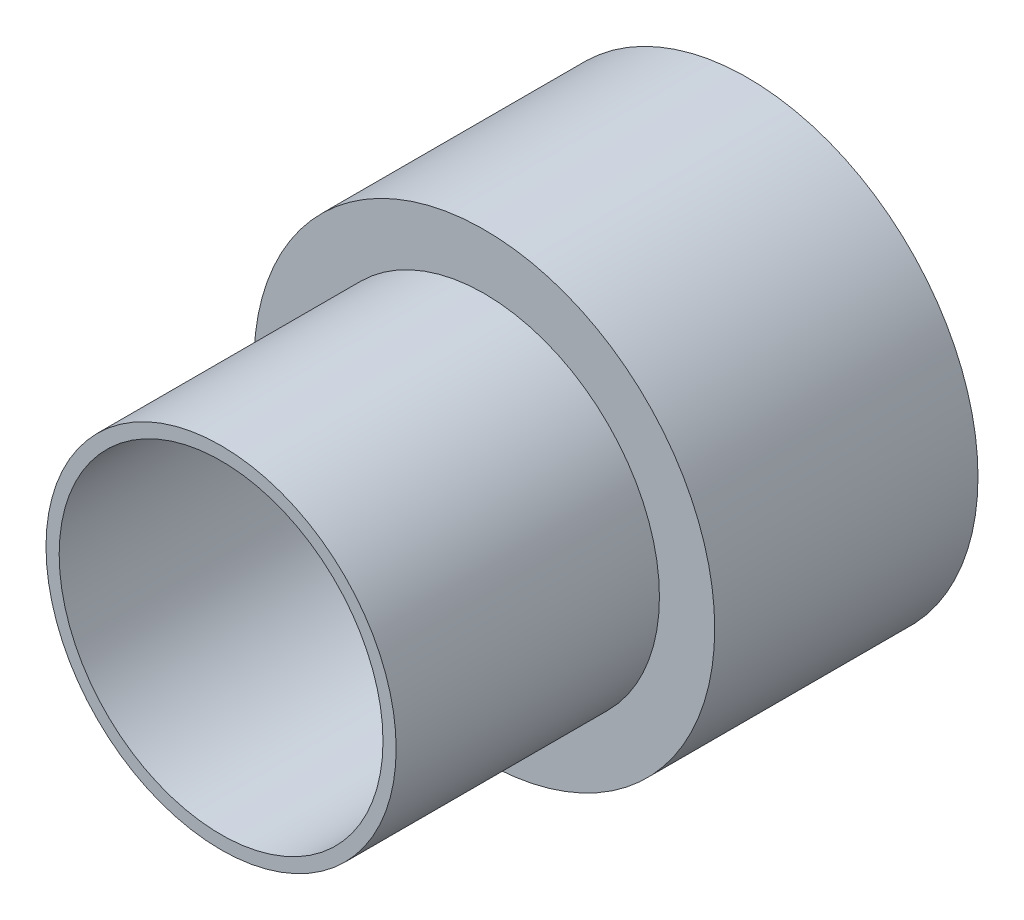
from build123d import *

# Parameters (mm, degrees)
SKETCH1_R           = 22.225
BOSS_EXTRUDE1_DEPTH = 25.4
SKETCH2_R           = 16.891
BOSS_EXTRUDE2_DEPTH = 25.4
SKETCH3_R           = 15.621
CUT_EXTRUDE1_DEPTH  = 50.8
SKETCH4_R           = 19.685
CUT_EXTRUDE2_DEPTH  = 22.225


with BuildPart() as part:
    # Sketch1 → Boss-Extrude1 (new body)
    with BuildSketch(Plane.XY):
        Circle(SKETCH1_R)
    extrude(amount=BOSS_EXTRUDE1_DEPTH)

    # Sketch2 → Boss-Extrude2 (add)
    with BuildSketch(Plane.XY.offset(25.4)):
        Circle(SKETCH2_R)
    extrude(amount=BOSS_EXTRUDE2_DEPTH)

    # Sketch3 → Cut-Extrude1 (cut)
    with BuildSketch(Plane.XY.offset(50.8)):
        Circle(SKETCH3_R)
    extrude(amount=-CUT_EXTRUDE1_DEPTH, mode=Mode.SUBTRACT)

    # Sketch4 → Cut-Extrude2 (cut)
    with BuildSketch(Plane(origin=(0, 0, 0), x_dir=(-1, 0, 0), z_dir=(0, 0, -1))):
        Circle(SKETCH4_R)
    extrude(amount=-CUT_EXTRUDE2_DEPTH, mode=Mode.SUBTRACT)


solid = part.part
